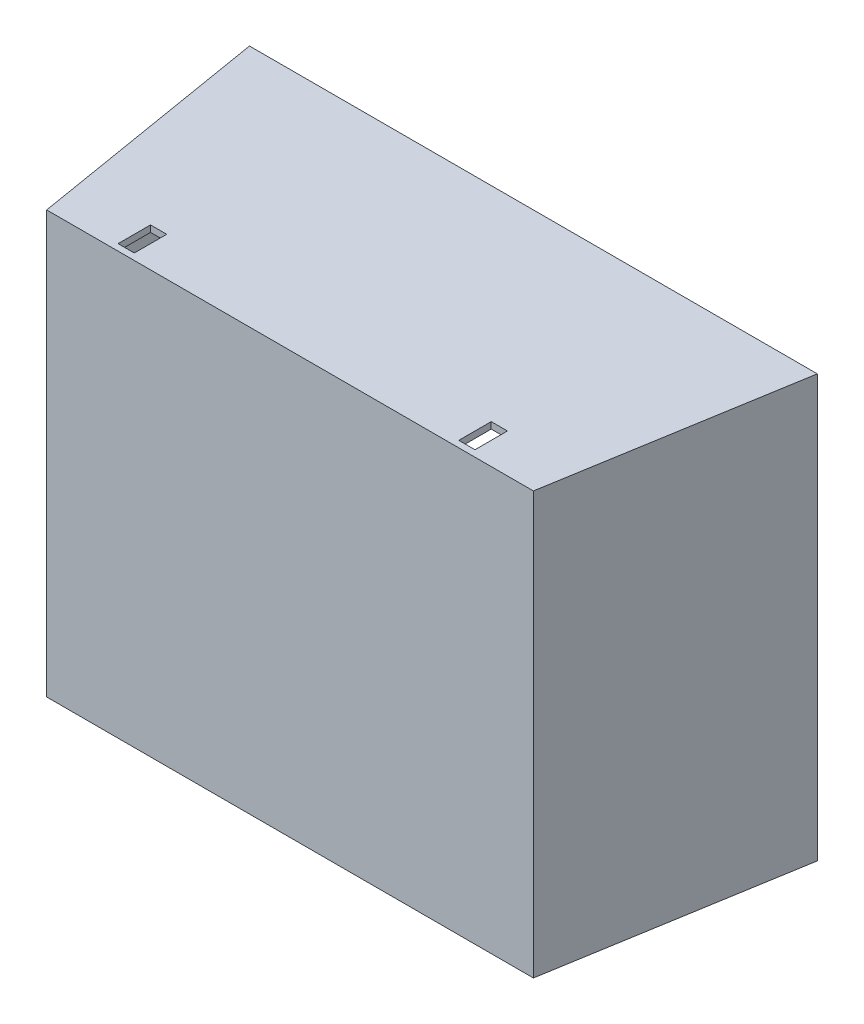
from build123d import *

# Parameters (mm, degrees)
EXTRUDE_2_DEPTH     = 130
SHELL_2_T           = -4
SKETCH_5_W          = 10
SKETCH_5_H          = 20
CUT_EXTRUDE_1_DEPTH = 260


with BuildPart() as part:
    # 草图1 → 凸台-拉伸2 (new, symmetric)
    with BuildSketch(Plane(origin=(0, 0, 0), x_dir=(1, 0, 0), z_dir=(0, 1, 0))):
        Polygon((175, 0), (-175, 0), (-150, -150), (150, -150), align=None)
    extrude(amount=EXTRUDE_2_DEPTH, both=True)

    # 抽壳2
    shell_2_openings = [part.faces().sort_by_distance(p)[0] for p in [
        (0, 0, 0),
    ]]
    offset(amount=SHELL_2_T, openings=shell_2_openings, kind=Kind.INTERSECTION)

    # 草图5 → 切除-拉伸1 (cut)
    with BuildSketch(Plane(origin=(0, 130, 0), x_dir=(1, 0, 0), z_dir=(0, 1, 0))):
        with Locations((-105, -136)):
            Rectangle(SKETCH_5_W, SKETCH_5_H)
        with Locations((105, -136)):
            Rectangle(SKETCH_5_W, SKETCH_5_H)
    extrude(amount=-CUT_EXTRUDE_1_DEPTH, mode=Mode.SUBTRACT)


solid = part.part
